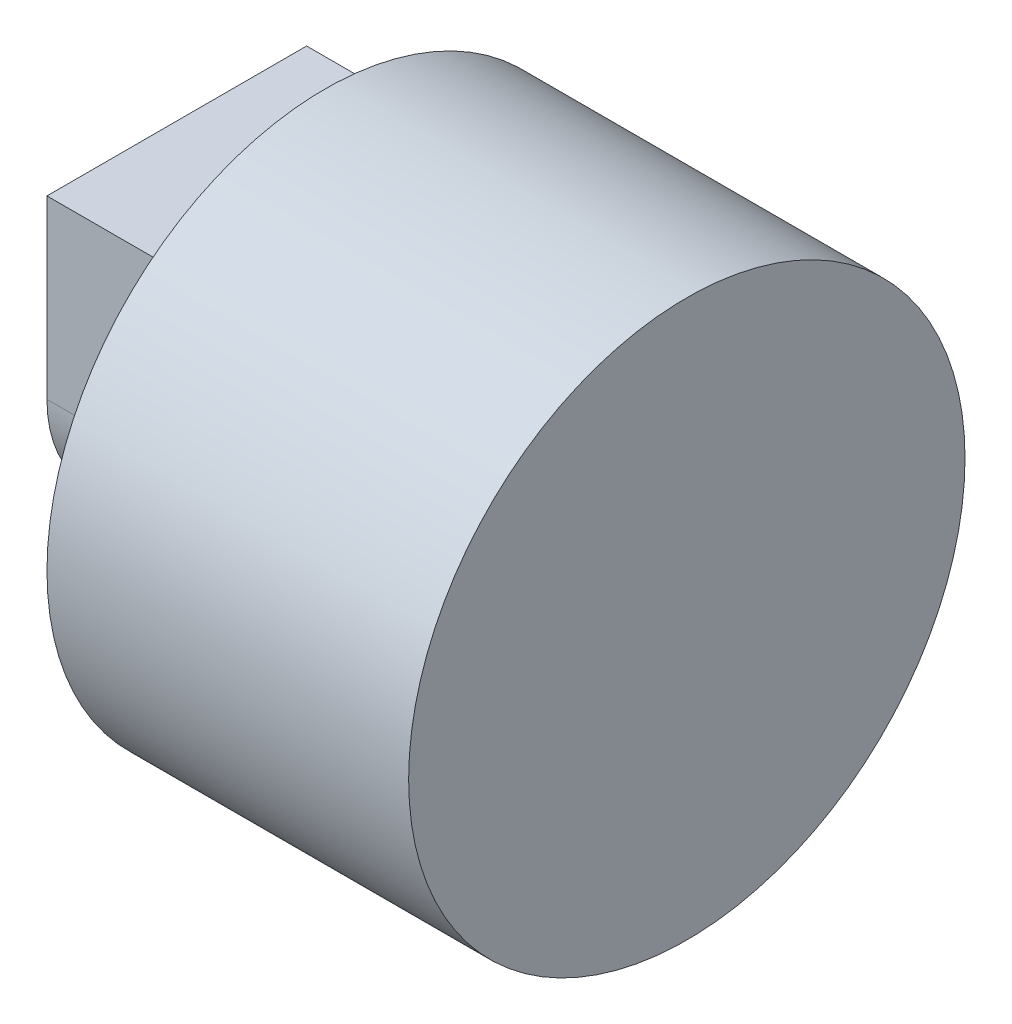
from build123d import *

# Parameters (mm, degrees)
SKETCH1_W           = 19.5
SKETCH1_H           = 15
BOSS_EXTRUDE1_DEPTH = 8
CUT_EXTRUDE1_START  = -10
SKETCH3_R           = 3
CUT_EXTRUDE1_DEPTH  = 10


with BuildPart() as part:
    # Sketch1 → Revolve1 (revolve)
    with BuildSketch(Plane.XY, mode=Mode.PRIVATE) as revolve1_sk:
        with Locations((9.75, 7.5)):
            Rectangle(SKETCH1_W, SKETCH1_H)
    revolve(revolve1_sk.sketch.rotate(Axis((0, 0, 0), (1, 0, 0)), 90), axis=Axis((0, 0, 0), (1, 0, 0)))

    # Sketch2 → Boss-Extrude1 (add)
    with BuildSketch(Plane.ZY):
        with BuildLine():
            Line((-7, 0), (-7, 9.5))
            Line((-7, 9.5), (7, 9.5))
            Line((7, 9.5), (7, 0))
            ThreePointArc((7, 0), (0, -7), (-7, 0))
        make_face()
        with BuildLine():
            Line((-3, 0), (-3, 5.5))
            Line((-3, 5.5), (3, 5.5))
            Line((3, 5.5), (3, 0))
            ThreePointArc((3, 0), (0, -3), (-3, 0))
        make_face(mode=Mode.SUBTRACT)
    extrude(amount=BOSS_EXTRUDE1_DEPTH)

    # Sketch3 → Cut-Extrude1 (cut)
    with BuildSketch(Plane.ZY.offset(CUT_EXTRUDE1_START)):
        Circle(SKETCH3_R)
    extrude(amount=CUT_EXTRUDE1_DEPTH, mode=Mode.SUBTRACT)


solid = part.part
